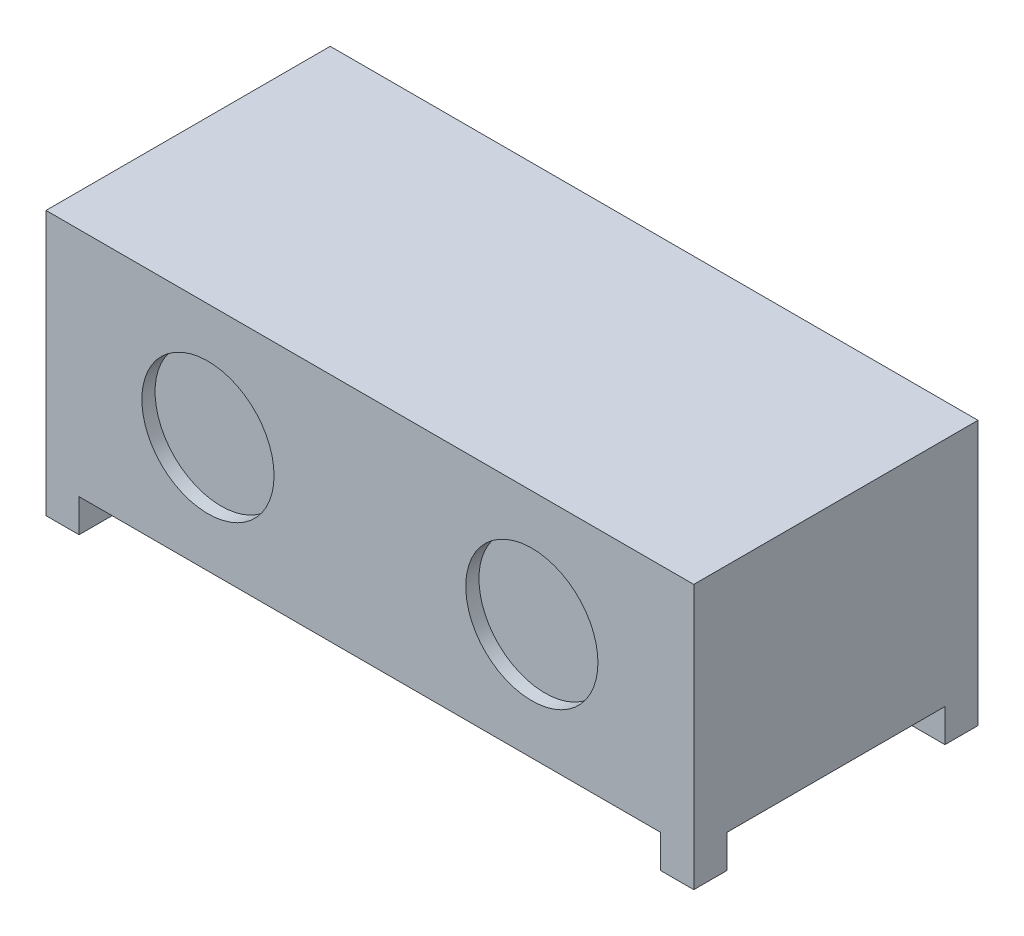
from build123d import *

# Parameters (mm, degrees)
SKETCH1_W           = 2489.2
SKETCH1_H           = 1092.2
BOSS_EXTRUDE1_DEPTH = 889
SKETCH2_R           = 254
CUT_EXTRUDE1_DEPTH  = 50.8
SKETCH3_W           = 127
SKETCH3_H           = 127
BOSS_EXTRUDE2_DEPTH = 127


with BuildPart() as part:
    # Sketch1 → Boss-Extrude1 (new body)
    with BuildSketch(Plane(origin=(0, 0, 0), x_dir=(1, 0, 0), z_dir=(0, 1, 0))):
        Rectangle(SKETCH1_W, SKETCH1_H)
    extrude(amount=BOSS_EXTRUDE1_DEPTH)

    # Sketch2 → Cut-Extrude1 (cut)
    with BuildSketch(Plane.XY.offset(546.1)):
        with Locations((622.3, 444.5)):
            Circle(SKETCH2_R)
        with Locations((-622.3, 444.5)):
            Circle(SKETCH2_R)
    extrude(amount=-CUT_EXTRUDE1_DEPTH, mode=Mode.SUBTRACT)

    # Sketch3 → Boss-Extrude2 (add)
    with BuildSketch(Plane.XZ):
        with Locations((-1181.1, 482.6)):
            Rectangle(SKETCH3_W, SKETCH3_H)
        with Locations((-1181.1, -482.6)):
            Rectangle(SKETCH3_W, SKETCH3_H)
        with Locations((1181.1, 482.6)):
            Rectangle(SKETCH3_W, SKETCH3_H)
        with Locations((1181.1, -482.6)):
            Rectangle(SKETCH3_W, SKETCH3_H)
    extrude(amount=BOSS_EXTRUDE2_DEPTH)


solid = part.part
